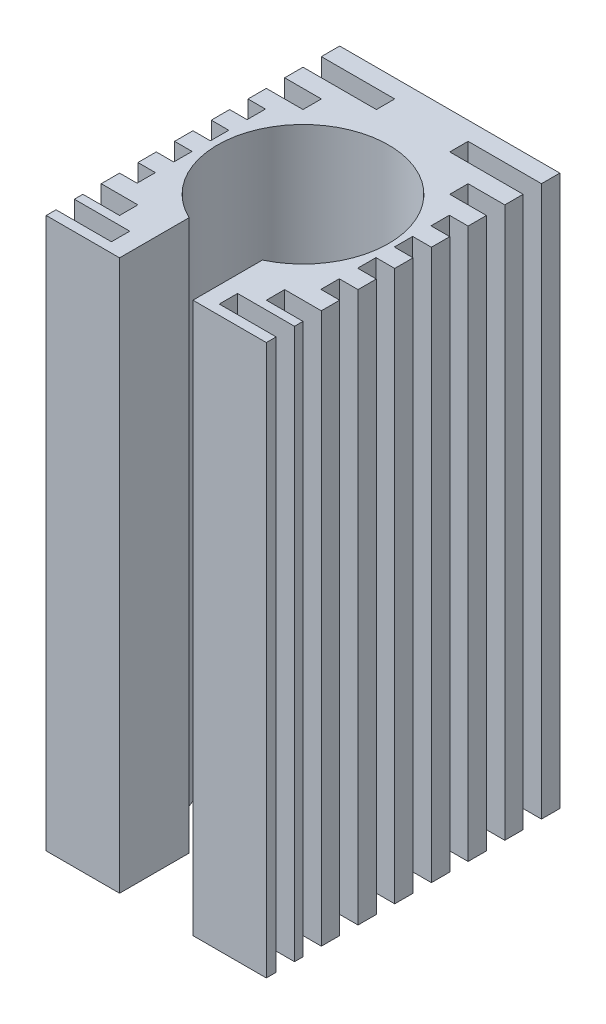
from build123d import *

# Parameters (mm, degrees)
SKETCH1_W           = 6
SKETCH1_H           = 8
BOSS_EXTRUDE1_DEPTH = 15
CUT_EXTRUDE2_DEPTH  = 15
SKETCH3_W           = 1.55025835
SKETCH3_H           = 0.5
SKETCH3_W_2         = 0.44974165
SKETCH3_W_3         = 1
SKETCH3_W_4         = 0.511037603
SKETCH3_W_5         = 1.033479195
SKETCH3_W_6         = 0.476588297
SKETCH3_W_7         = 0.523411703
SKETCH3_W_8         = 0.489932508
CUT_EXTRUDE3_DEPTH  = 15


with BuildPart() as part:
    # Sketch1 → Boss-Extrude1 (new body)
    with BuildSketch(Plane(origin=(0, 0, 0), x_dir=(1, 0, 0), z_dir=(0, 1, 0))):
        with Locations((3, 4)):
            Rectangle(SKETCH1_W, SKETCH1_H)
    extrude(amount=BOSS_EXTRUDE1_DEPTH)

    # Sketch2 → Cut-Extrude2 (cut)
    with BuildSketch(Plane(origin=(0, 15, 0), x_dir=(1, 0, 0), z_dir=(0, 1, 0))):
        with BuildLine():
            Line((4, 0), (2, 0))
            Line((2, 0), (2, 1.894320503))
            ThreePointArc((2, 1.894320503), (3, 6.331069742), (4, 1.894320503))
            Line((4, 1.894320503), (4, 0))
        make_face()
    extrude(amount=-CUT_EXTRUDE2_DEPTH, mode=Mode.SUBTRACT)

    # Sketch3 → Cut-Extrude3 (cut)
    with BuildSketch(Plane(origin=(0, 15, 0), x_dir=(1, 0, 0), z_dir=(0, 1, 0))):
        with Locations((5.224870825, 7.25)):
            Rectangle(SKETCH3_W, SKETCH3_H)
        with Locations((4.224870825, 7.25)):
            Rectangle(SKETCH3_W_2, SKETCH3_H)
        with Locations((5.5, 6.25)):
            Rectangle(SKETCH3_W_3, SKETCH3_H)
        with Locations((5.744481199, 5.25)):
            Rectangle(SKETCH3_W_4, SKETCH3_H)
        with Locations((5.744481199, 4.25)):
            Rectangle(SKETCH3_W_4, SKETCH3_H)
        with Locations((5.744481199, 3.25)):
            Rectangle(SKETCH3_W_4, SKETCH3_H)
        with Locations((5.744481199, 2.25)):
            Rectangle(SKETCH3_W_4, SKETCH3_H)
        with Locations((5.5, 1.25)):
            Rectangle(SKETCH3_W_3, SKETCH3_H)
        with Locations((5.224870825, 0.517991792)):
            Rectangle(SKETCH3_W, SKETCH3_H)
        with Locations((0.993327895, 0.517991792)):
            Rectangle(SKETCH3_W_5, SKETCH3_H)
        with Locations((0.238294149, 0.517991792)):
            Rectangle(SKETCH3_W_6, SKETCH3_H)
        with Locations((0.238294149, 1.25)):
            Rectangle(SKETCH3_W_6, SKETCH3_H)
        with Locations((0.738294149, 1.25)):
            Rectangle(SKETCH3_W_7, SKETCH3_H)
        with Locations((0.238294149, 2.25)):
            Rectangle(SKETCH3_W_6, SKETCH3_H)
        with Locations((0.238294149, 3.25)):
            Rectangle(SKETCH3_W_6, SKETCH3_H)
        with Locations((0.238294149, 4.25)):
            Rectangle(SKETCH3_W_6, SKETCH3_H)
        with Locations((0.238294149, 5.25)):
            Rectangle(SKETCH3_W_6, SKETCH3_H)
        with Locations((0.238294149, 6.25)):
            Rectangle(SKETCH3_W_6, SKETCH3_H)
        with Locations((0.993327895, 7.25)):
            Rectangle(SKETCH3_W_5, SKETCH3_H)
        with Locations((0.238294149, 7.25)):
            Rectangle(SKETCH3_W_6, SKETCH3_H)
        with Locations((1.755033746, 7.25)):
            Rectangle(SKETCH3_W_8, SKETCH3_H)
        with Locations((0.738294149, 6.25)):
            Rectangle(SKETCH3_W_7, SKETCH3_H)
    extrude(amount=-CUT_EXTRUDE3_DEPTH, mode=Mode.SUBTRACT)


solid = part.part
